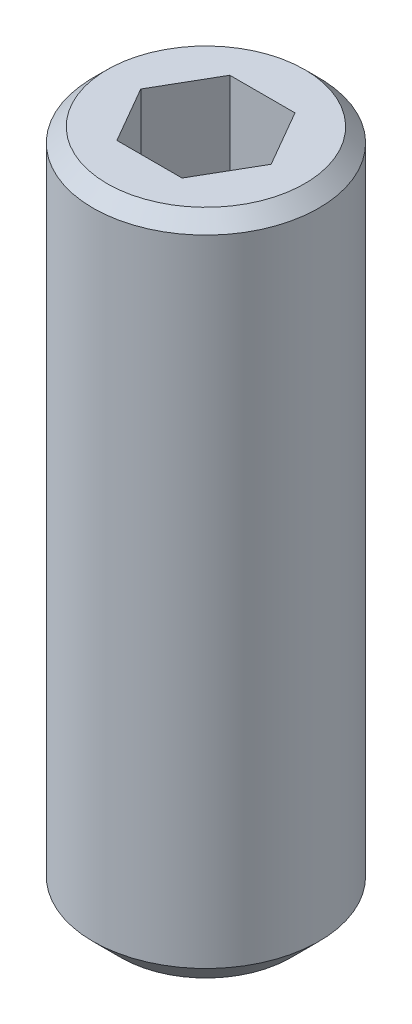
from build123d import *

# Parameters (mm, degrees)
SKETCH1_R      = 2
EXTRUDE1_DEPTH = 12
CHAMFER1_SIZE  = 0.25
CHAMFER2_SIZE  = 0.5
EXTRUDE2_DEPTH = 1.5


with BuildPart() as part:
    # Sketch1 → Extrude1 (new body)
    with BuildSketch(Plane(origin=(0, 0, 0), x_dir=(1, 0, 0), z_dir=(0, 1, 0))):
        with Locations(Location((0, 0, 0), (0, 0, 270))):
            Circle(SKETCH1_R)
    extrude(amount=EXTRUDE1_DEPTH)

    # Chamfer1
    chamfer1_edges = [part.edges().sort_by_distance(p)[0] for p in [
        (0, 12, -2),
    ]]
    chamfer(chamfer1_edges, length=CHAMFER1_SIZE)

    # Chamfer2
    chamfer2_edges = [part.edges().sort_by_distance(p)[0] for p in [
        (0, 0, -2),
    ]]
    chamfer(chamfer2_edges, length=CHAMFER2_SIZE)

    # Sketch2 → Extrude2 (cut)
    with BuildSketch(Plane(origin=(0, 12, 0), x_dir=(1, 0, 0), z_dir=(0, 1, 0))):
        Polygon((-1.154700538, 0), (-0.577350269, -1), (0.577350269, -1), (1.154700538, 0), (0.577350269, 1), (-0.577350269, 1), align=None)
    extrude(amount=-EXTRUDE2_DEPTH, mode=Mode.SUBTRACT)


solid = part.part
